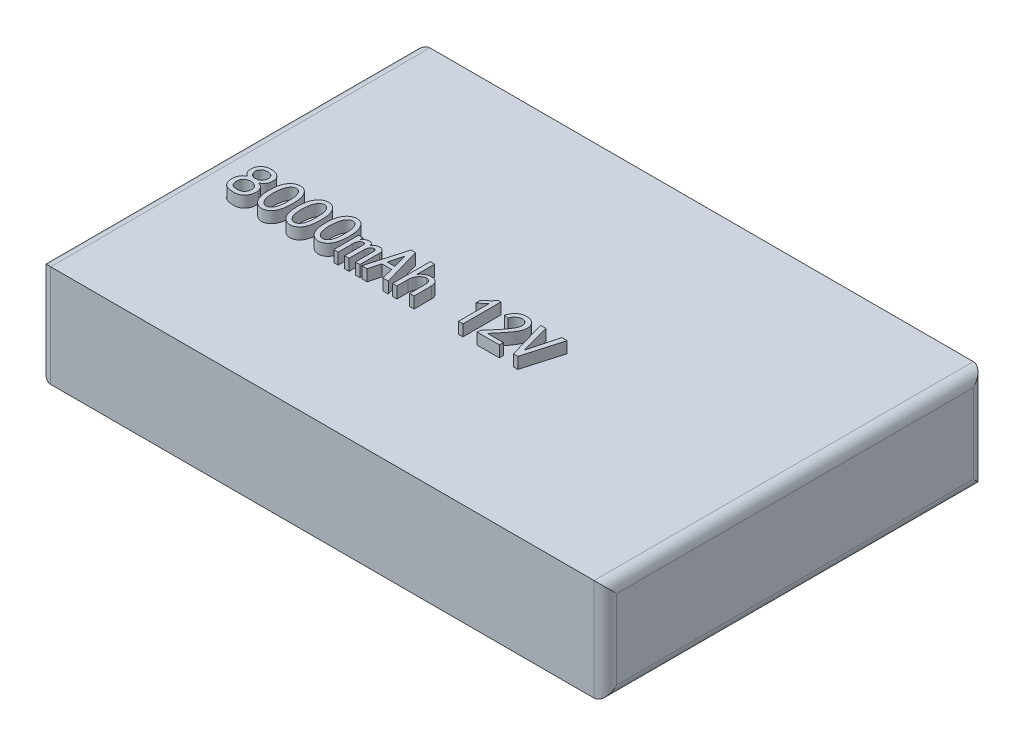
from build123d import *

# Parameters (mm, degrees)
SKETCH_1_W      = 100
SKETCH_1_H      = 67
EXTRUDE_1_DEPTH = 18
FILLET_1_R      = 2
EXTRUDE_2_DEPTH = 2


with BuildPart() as part:
    # 草图1 → 凸台-拉伸1 (new body)
    with BuildSketch(Plane(origin=(0, 0, 0), x_dir=(1, 0, 0), z_dir=(0, 1, 0))):
        with Locations((50, 33.5)):
            Rectangle(SKETCH_1_W, SKETCH_1_H)
    extrude(amount=EXTRUDE_1_DEPTH)

    # 圆角1
    fillet_1_edges = [part.edges().sort_by_distance(p)[0] for p in [
        (100, 18, -33.5),
        (0, 18, -33.5),
        (100, 0, -33.5),
        (0, 0, -33.5),
        (0, 9, -67),
        (100, 9, -67),
        (100, 9, 0),
        (0, 9, 0),
    ]]
    fillet(fillet_1_edges, radius=FILLET_1_R)

    # 草图3 → 凸台-拉伸2 (add)
    # profile 1 of 10: a face of its own
    with BuildSketch(Plane(origin=(0, 18, 0), x_dir=(1, 0, 0), z_dir=(0, 1, 0))):
        with BuildLine():
            add(Edge.make_bspline(
                [(11.582452743, 29.410355401), (11.586166957, 29.494181149), (11.593411207, 29.657675952), (11.614341343, 29.896069815), (11.639616615, 30.121689523), (11.672477807, 30.333845078), (11.713092583, 30.531830322), (11.759063521, 30.716682862), (11.812190182, 30.887885478), (11.890418071, 31.096974004), (12.007724524, 31.337632365), (12.17551857, 31.602133148), (12.370500827, 31.83990075), (12.554960243, 32.014120852), (12.714899037, 32.136737773), (12.842687085, 32.216348969), (12.976940509, 32.284370743), (13.11809958, 32.339843928), (13.265904721, 32.381166107), (13.419964352, 32.411673837), (13.580786928, 32.430546383), (13.746506674, 32.436161198), (13.913475146, 32.428299435), (14.077497758, 32.402688022), (14.235776716, 32.357221219), (14.388420095, 32.294802478), (14.535012479, 32.214602133), (14.67629178, 32.117264395), (14.81058309, 32.000271989), (14.939560133, 31.868375372), (15.060028466, 31.723212648), (15.170377192, 31.567585354), (15.270147919, 31.403098761), (15.358010789, 31.228850487), (15.436769418, 31.046377026), (15.502840905, 30.854053039), (15.557503666, 30.652659874), (15.617695927, 30.368156703), (15.670652066, 29.990770611), (15.707960335, 29.51314411), (15.71647351, 29.00386048), (15.703797245, 28.563434408), (15.679902191, 28.206587686), (15.652736156, 27.947762316), (15.616247461, 27.702126844), (15.573770277, 27.468485624), (15.52062875, 27.248081167), (15.457655471, 27.040677316), (15.389615667, 26.844919163), (15.309529144, 26.662864424), (15.222302353, 26.492967001), (15.122856353, 26.337403201), (15.015120496, 26.194071783), (14.896238839, 26.064108594), (14.764662525, 25.950131612), (14.624969299, 25.846641024), (14.473407586, 25.75855888), (14.314016088, 25.683812601), (14.149854846, 25.624324089), (13.982973327, 25.585551237), (13.816519664, 25.562506214), (13.649320878, 25.562421907), (13.482367588, 25.576959075), (13.316345433, 25.615199921), (13.149206573, 25.667776944), (12.985427889, 25.742130813), (12.827794772, 25.82774556), (12.679419983, 25.919892751), (12.544358408, 26.02016211), (12.42153089, 26.127241524), (12.309405193, 26.24023194), (12.209304568, 26.360206013), (12.122268009, 26.487495944), (12.025006237, 26.666639588), (11.920807817, 26.897713187), (11.812963032, 27.182340357), (11.724821117, 27.473813879), (11.668144071, 27.724292172), (11.630776974, 27.933836421), (11.61021753, 28.10561054), (11.592358561, 28.290518629), (11.581565112, 28.488603766), (11.574385651, 28.700037692), (11.571261028, 28.924971028), (11.57460539, 29.163377605), (11.579790778, 29.326576014), (11.582452743, 29.410355401)],
                knots=[0, 0, 0, 0, 1.18043416, 2.302333746, 3.366253517, 4.374302266, 5.321670991, 6.208995316, 7.053297808, 7.84229274, 9.348259463, 10.810477328, 12.240076564, 13.663562249, 14.3695339, 15.072606272, 15.778577923, 16.484387009, 17.202829605, 17.934942377, 18.692112664, 19.478485278, 20.265441384, 21.040673806, 21.808439453, 22.577161074, 23.356320991, 24.155029842, 24.986154494, 25.858111265, 26.748121484, 27.637306138, 28.540117759, 29.452135788, 30.380885827, 31.334339875, 32.310628684, 33.31521083, 35.42407972, 37.666773946, 40.052062172, 42.587025658, 43.863776122, 45.083322308, 46.247467896, 47.357025429, 48.423487632, 49.435172604, 50.405897663, 51.337337341, 52.231284254, 53.090220275, 53.931690991, 54.751583713, 55.562922169, 56.377338113, 57.194202079, 58.024663732, 58.851830165, 59.645552351, 60.431282623, 61.21044254, 61.99312915, 62.783838437, 63.60230231, 64.454612977, 65.309477934, 66.125301685, 66.909862715, 67.67340185, 68.415973016, 69.147238889, 69.868837108, 70.581506411, 72.0124375, 73.431838244, 74.861437481, 76.292961888, 77.042577341, 77.855187732, 78.726196438, 79.655959089, 80.645695907, 81.702690171, 82.820655125, 84, 84, 84, 84], degree=3))
        make_face()
        with BuildLine():
            add(Edge.make_bspline(
                [(12.401539305, 29.644380133), (12.392684128, 29.556316156), (12.375239122, 29.382827059), (12.360971218, 29.125459373), (12.356905251, 28.87537721), (12.360628569, 28.632479454), (12.374987458, 28.39724135), (12.399486149, 28.169207664), (12.434383806, 27.948538457), (12.477095455, 27.735818913), (12.528269894, 27.534448947), (12.588958673, 27.347164468), (12.658037112, 27.175329805), (12.734454099, 27.018686114), (12.818336594, 26.877046397), (12.911246582, 26.751214957), (13.010577381, 26.638514934), (13.119297521, 26.543803902), (13.230805841, 26.464267079), (13.344810676, 26.402467713), (13.45945268, 26.358676649), (13.575169416, 26.331900897), (13.691543793, 26.32335157), (13.808622211, 26.331632833), (13.925538636, 26.360536617), (14.041712329, 26.404835723), (14.153810223, 26.465849536), (14.259858752, 26.539524022), (14.357646773, 26.627507132), (14.447225988, 26.728854462), (14.528084162, 26.844192914), (14.602067943, 26.971550667), (14.667031324, 27.113040129), (14.743422668, 27.320205932), (14.820356046, 27.596095278), (14.888801583, 27.940842573), (14.929172439, 28.300369068), (14.939757254, 28.669243147), (14.932875016, 29.035765135), (14.924620637, 29.390823499), (14.904772683, 29.728418911), (14.881018622, 30.050270424), (14.840705762, 30.357815017), (14.76641453, 30.649441858), (14.662354326, 30.925941717), (14.555547801, 31.144210199), (14.453187433, 31.302648539), (14.372494355, 31.408956109), (14.282784238, 31.497788826), (14.188190124, 31.573519249), (14.086511533, 31.631174389), (13.978667996, 31.6743018), (13.864706605, 31.7010282), (13.746354409, 31.714206477), (13.62711863, 31.711902736), (13.510000311, 31.690974622), (13.396407403, 31.65437425), (13.285625158, 31.602269173), (13.179977891, 31.531746383), (13.077776888, 31.445433067), (12.980173521, 31.341875788), (12.88402792, 31.223885099), (12.796326402, 31.086874891), (12.715217994, 30.933397711), (12.643289933, 30.761481611), (12.578870916, 30.572121592), (12.521016428, 30.365327934), (12.472372443, 30.14097623), (12.432006531, 29.898887664), (12.41192654, 29.731149752), (12.401539305, 29.644380133)],
                knots=[0, 0, 0, 0, 1.378198314, 2.715098627, 4.012594964, 5.272602849, 6.497213731, 7.681415101, 8.842769074, 9.975170128, 11.059162755, 12.076494648, 13.038717388, 13.940857576, 14.788360499, 15.598271168, 16.373595835, 17.122768248, 17.838466736, 18.502782022, 19.136468245, 19.744060339, 20.345653328, 20.947246317, 21.563841626, 22.214212994, 22.87852828, 23.546305104, 24.220743313, 24.921956094, 25.648106704, 26.41081768, 27.212668989, 28.069279432, 29.84713992, 31.666334073, 33.537864714, 35.473745168, 37.408579624, 39.246547954, 41.003985019, 42.674193204, 44.272363647, 45.827394737, 47.348405091, 48.867584295, 49.599750274, 50.283750763, 50.94125936, 51.560811542, 52.165388272, 52.754418158, 53.363720025, 53.982318455, 54.604903792, 55.213928724, 55.828148287, 56.458765578, 57.113918044, 57.800421407, 58.537638978, 59.326979919, 60.167286366, 61.066273245, 62.027297208, 63.065989643, 64.179487018, 65.369443928, 66.639232213, 68, 68, 68, 68], degree=3))
        make_face(mode=Mode.SUBTRACT)
    # profile 2 of 10: a face of its own
    with BuildSketch(Plane(origin=(0, 18, 0), x_dir=(1, 0, 0), z_dir=(0, 1, 0))):
        with BuildLine():
            add(Edge.make_bspline(
                [(16.574980359, 29.410355401), (16.578694572, 29.494181149), (16.585938822, 29.657675952), (16.606868959, 29.896069815), (16.63214423, 30.121689523), (16.665005422, 30.333845078), (16.705620198, 30.531830322), (16.751591136, 30.716682862), (16.804717797, 30.887885478), (16.882945687, 31.096974004), (17.000252139, 31.337632365), (17.168046186, 31.602133148), (17.363028442, 31.83990075), (17.547487859, 32.014120852), (17.707426652, 32.136737773), (17.8352147, 32.216348969), (17.969468124, 32.284370743), (18.110627196, 32.339843928), (18.258432337, 32.381166107), (18.412491967, 32.411673837), (18.573314544, 32.430546383), (18.73903429, 32.436161198), (18.906002761, 32.428299435), (19.070025374, 32.402688022), (19.228304331, 32.357221219), (19.380947711, 32.294802478), (19.527540094, 32.214602133), (19.668819395, 32.117264395), (19.803110705, 32.000271989), (19.932087748, 31.868375372), (20.052556082, 31.723212648), (20.162904807, 31.567585354), (20.262675535, 31.403098761), (20.350538404, 31.228850487), (20.429297033, 31.046377026), (20.49536852, 30.854053039), (20.550031281, 30.652659874), (20.610223542, 30.368156703), (20.663179682, 29.990770611), (20.70048795, 29.51314411), (20.709001126, 29.00386048), (20.69632486, 28.563434408), (20.672429806, 28.206587686), (20.645263772, 27.947762316), (20.608775076, 27.702126844), (20.566297893, 27.468485624), (20.513156365, 27.248081167), (20.450183086, 27.040677316), (20.382143282, 26.844919163), (20.302056759, 26.662864424), (20.214829968, 26.492967001), (20.115383969, 26.337403201), (20.007648111, 26.194071783), (19.888766455, 26.064108594), (19.757190141, 25.950131612), (19.617496914, 25.846641024), (19.465935201, 25.75855888), (19.306543704, 25.683812601), (19.142382461, 25.624324089), (18.975500942, 25.585551237), (18.80904728, 25.562506214), (18.641848494, 25.562421907), (18.474895203, 25.576959075), (18.308873048, 25.615199921), (18.141734188, 25.667776944), (17.977955504, 25.742130813), (17.820322387, 25.82774556), (17.671947598, 25.919892751), (17.536886023, 26.02016211), (17.414058505, 26.127241524), (17.301932808, 26.24023194), (17.201832183, 26.360206013), (17.114795624, 26.487495944), (17.017533853, 26.666639588), (16.913335433, 26.897713187), (16.805490648, 27.182340357), (16.717348732, 27.473813879), (16.660671687, 27.724292172), (16.623304589, 27.933836421), (16.602745145, 28.10561054), (16.584886176, 28.290518629), (16.574092727, 28.488603766), (16.566913266, 28.700037692), (16.563788644, 28.924971028), (16.567133006, 29.163377605), (16.572318393, 29.326576014), (16.574980359, 29.410355401)],
                knots=[0, 0, 0, 0, 1.18043416, 2.302333746, 3.366253517, 4.374302266, 5.321670991, 6.208995316, 7.053297808, 7.84229274, 9.348259463, 10.810477328, 12.240076564, 13.663562249, 14.3695339, 15.072606272, 15.778577923, 16.484387009, 17.202829605, 17.934942377, 18.692112664, 19.478485278, 20.265441384, 21.040673806, 21.808439453, 22.577161074, 23.356320991, 24.155029842, 24.986154494, 25.858111265, 26.748121484, 27.637306138, 28.540117759, 29.452135788, 30.380885827, 31.334339875, 32.310628684, 33.31521083, 35.42407972, 37.666773946, 40.052062172, 42.587025658, 43.863776122, 45.083322308, 46.247467896, 47.357025429, 48.423487632, 49.435172604, 50.405897663, 51.337337341, 52.231284254, 53.090220275, 53.931690991, 54.751583713, 55.562922169, 56.377338113, 57.194202079, 58.024663732, 58.851830165, 59.645552351, 60.431282623, 61.21044254, 61.99312915, 62.783838437, 63.60230231, 64.454612977, 65.309477934, 66.125301685, 66.909862715, 67.67340185, 68.415973016, 69.147238889, 69.868837108, 70.581506411, 72.0124375, 73.431838244, 74.861437481, 76.292961888, 77.042577341, 77.855187732, 78.726196438, 79.655959089, 80.645695907, 81.702690171, 82.820655125, 84, 84, 84, 84], degree=3))
        make_face()
        with BuildLine():
            add(Edge.make_bspline(
                [(17.39406692, 29.644380133), (17.385211744, 29.556316156), (17.367766737, 29.382827059), (17.353498833, 29.125459373), (17.349432866, 28.87537721), (17.353156185, 28.632479454), (17.367515074, 28.39724135), (17.392013765, 28.169207664), (17.426911422, 27.948538457), (17.469623071, 27.735818913), (17.52079751, 27.534448947), (17.581486289, 27.347164468), (17.650564728, 27.175329805), (17.726981714, 27.018686114), (17.810864209, 26.877046397), (17.903774198, 26.751214957), (18.003104997, 26.638514934), (18.111825136, 26.543803902), (18.223333456, 26.464267079), (18.337338292, 26.402467713), (18.451980295, 26.358676649), (18.567697031, 26.331900897), (18.684071408, 26.32335157), (18.801149827, 26.331632833), (18.918066252, 26.360536617), (19.034239944, 26.404835723), (19.146337838, 26.465849536), (19.252386367, 26.539524022), (19.350174389, 26.627507132), (19.439753603, 26.728854462), (19.520611778, 26.844192914), (19.594595558, 26.971550667), (19.65955894, 27.113040129), (19.735950284, 27.320205932), (19.812883661, 27.596095278), (19.881329199, 27.940842573), (19.921700054, 28.300369068), (19.93228487, 28.669243147), (19.925402631, 29.035765135), (19.917148253, 29.390823499), (19.897300298, 29.728418911), (19.873546237, 30.050270424), (19.833233377, 30.357815017), (19.758942146, 30.649441858), (19.654881941, 30.925941717), (19.548075417, 31.144210199), (19.445715049, 31.302648539), (19.36502197, 31.408956109), (19.275311854, 31.497788826), (19.180717739, 31.573519249), (19.079039148, 31.631174389), (18.971195611, 31.6743018), (18.85723422, 31.7010282), (18.738882024, 31.714206477), (18.619646245, 31.711902736), (18.502527926, 31.690974622), (18.388935018, 31.65437425), (18.278152773, 31.602269173), (18.172505506, 31.531746383), (18.070304503, 31.445433067), (17.972701136, 31.341875788), (17.876555536, 31.223885099), (17.788854017, 31.086874891), (17.70774561, 30.933397711), (17.635817548, 30.761481611), (17.571398531, 30.572121592), (17.513544044, 30.365327934), (17.464900059, 30.14097623), (17.424534146, 29.898887664), (17.404454156, 29.731149752), (17.39406692, 29.644380133)],
                knots=[0, 0, 0, 0, 1.378198314, 2.715098627, 4.012594964, 5.272602849, 6.497213731, 7.681415101, 8.842769074, 9.975170128, 11.059162755, 12.076494648, 13.038717388, 13.940857576, 14.788360499, 15.598271168, 16.373595835, 17.122768248, 17.838466736, 18.502782022, 19.136468245, 19.744060339, 20.345653328, 20.947246317, 21.563841626, 22.214212994, 22.87852828, 23.546305104, 24.220743313, 24.921956094, 25.648106704, 26.41081768, 27.212668989, 28.069279432, 29.84713992, 31.666334073, 33.537864714, 35.473745168, 37.408579624, 39.246547954, 41.003985019, 42.674193204, 44.272363647, 45.827394737, 47.348405091, 48.867584295, 49.599750274, 50.283750763, 50.94125936, 51.560811542, 52.165388272, 52.754418158, 53.363720025, 53.982318455, 54.604903792, 55.213928724, 55.828148287, 56.458765578, 57.113918044, 57.800421407, 58.537638978, 59.326979919, 60.167286366, 61.066273245, 62.027297208, 63.065989643, 64.179487018, 65.369443928, 66.639232213, 68, 68, 68, 68], degree=3))
        make_face(mode=Mode.SUBTRACT)
    # profile 3 of 10: a face of its own
    with BuildSketch(Plane(origin=(0, 18, 0), x_dir=(1, 0, 0), z_dir=(0, 1, 0))):
        with BuildLine():
            add(Edge.make_bspline(
                [(21.567507974, 29.410355401), (21.571222188, 29.494181149), (21.578466438, 29.657675952), (21.599396574, 29.896069815), (21.624671845, 30.121689523), (21.657533038, 30.333845078), (21.698147813, 30.531830322), (21.744118752, 30.716682862), (21.797245413, 30.887885478), (21.875473302, 31.096974004), (21.992779754, 31.337632365), (22.160573801, 31.602133148), (22.355556057, 31.83990075), (22.540015474, 32.014120852), (22.699954268, 32.136737773), (22.827742316, 32.216348969), (22.961995739, 32.284370743), (23.103154811, 32.339843928), (23.250959952, 32.381166107), (23.405019582, 32.411673837), (23.565842159, 32.430546383), (23.731561905, 32.436161198), (23.898530377, 32.428299435), (24.062552989, 32.402688022), (24.220831947, 32.357221219), (24.373475326, 32.294802478), (24.520067709, 32.214602133), (24.66134701, 32.117264395), (24.79563832, 32.000271989), (24.924615364, 31.868375372), (25.045083697, 31.723212648), (25.155432423, 31.567585354), (25.25520315, 31.403098761), (25.343066019, 31.228850487), (25.421824648, 31.046377026), (25.487896135, 30.854053039), (25.542558897, 30.652659874), (25.602751157, 30.368156703), (25.655707297, 29.990770611), (25.693015566, 29.51314411), (25.701528741, 29.00386048), (25.688852475, 28.563434408), (25.664957421, 28.206587686), (25.637791387, 27.947762316), (25.601302692, 27.702126844), (25.558825508, 27.468485624), (25.505683981, 27.248081167), (25.442710702, 27.040677316), (25.374670898, 26.844919163), (25.294584375, 26.662864424), (25.207357583, 26.492967001), (25.107911584, 26.337403201), (25.000175726, 26.194071783), (24.88129407, 26.064108594), (24.749717756, 25.950131612), (24.61002453, 25.846641024), (24.458462817, 25.75855888), (24.299071319, 25.683812601), (24.134910077, 25.624324089), (23.968028557, 25.585551237), (23.801574895, 25.562506214), (23.634376109, 25.562421907), (23.467422818, 25.576959075), (23.301400664, 25.615199921), (23.134261804, 25.667776944), (22.97048312, 25.742130813), (22.812850002, 25.82774556), (22.664475214, 25.919892751), (22.529413639, 26.02016211), (22.40658612, 26.127241524), (22.294460423, 26.24023194), (22.194359799, 26.360206013), (22.107323239, 26.487495944), (22.010061468, 26.666639588), (21.905863048, 26.897713187), (21.798018263, 27.182340357), (21.709876348, 27.473813879), (21.653199302, 27.724292172), (21.615832205, 27.933836421), (21.59527276, 28.10561054), (21.577413791, 28.290518629), (21.566620342, 28.488603766), (21.559440881, 28.700037692), (21.556316259, 28.924971028), (21.559660621, 29.163377605), (21.564846008, 29.326576014), (21.567507974, 29.410355401)],
                knots=[0, 0, 0, 0, 1.18043416, 2.302333746, 3.366253517, 4.374302266, 5.321670991, 6.208995316, 7.053297808, 7.84229274, 9.348259463, 10.810477328, 12.240076564, 13.663562249, 14.3695339, 15.072606272, 15.778577923, 16.484387009, 17.202829605, 17.934942377, 18.692112664, 19.478485278, 20.265441384, 21.040673806, 21.808439453, 22.577161074, 23.356320991, 24.155029842, 24.986154494, 25.858111265, 26.748121484, 27.637306138, 28.540117759, 29.452135788, 30.380885827, 31.334339875, 32.310628684, 33.31521083, 35.42407972, 37.666773946, 40.052062172, 42.587025658, 43.863776122, 45.083322308, 46.247467896, 47.357025429, 48.423487632, 49.435172604, 50.405897663, 51.337337341, 52.231284254, 53.090220275, 53.931690991, 54.751583713, 55.562922169, 56.377338113, 57.194202079, 58.024663732, 58.851830165, 59.645552351, 60.431282623, 61.21044254, 61.99312915, 62.783838437, 63.60230231, 64.454612977, 65.309477934, 66.125301685, 66.909862715, 67.67340185, 68.415973016, 69.147238889, 69.868837108, 70.581506411, 72.0124375, 73.431838244, 74.861437481, 76.292961888, 77.042577341, 77.855187732, 78.726196438, 79.655959089, 80.645695907, 81.702690171, 82.820655125, 84, 84, 84, 84], degree=3))
        make_face()
        with BuildLine():
            add(Edge.make_bspline(
                [(22.386594536, 29.644380133), (22.377739359, 29.556316156), (22.360294353, 29.382827059), (22.346026449, 29.125459373), (22.341960482, 28.87537721), (22.3456838, 28.632479454), (22.360042689, 28.39724135), (22.38454138, 28.169207664), (22.419439037, 27.948538457), (22.462150686, 27.735818913), (22.513325125, 27.534448947), (22.574013904, 27.347164468), (22.643092343, 27.175329805), (22.71950933, 27.018686114), (22.803391824, 26.877046397), (22.896301813, 26.751214957), (22.995632612, 26.638514934), (23.104352751, 26.543803902), (23.215861072, 26.464267079), (23.329865907, 26.402467713), (23.444507911, 26.358676649), (23.560224647, 26.331900897), (23.676599024, 26.32335157), (23.793677442, 26.331632833), (23.910593867, 26.360536617), (24.02676756, 26.404835723), (24.138865453, 26.465849536), (24.244913983, 26.539524022), (24.342702004, 26.627507132), (24.432281218, 26.728854462), (24.513139393, 26.844192914), (24.587123173, 26.971550667), (24.652086555, 27.113040129), (24.728477899, 27.320205932), (24.805411277, 27.596095278), (24.873856814, 27.940842573), (24.914227669, 28.300369068), (24.924812485, 28.669243147), (24.917930246, 29.035765135), (24.909675868, 29.390823499), (24.889827913, 29.728418911), (24.866073853, 30.050270424), (24.825760993, 30.357815017), (24.751469761, 30.649441858), (24.647409556, 30.925941717), (24.540603032, 31.144210199), (24.438242664, 31.302648539), (24.357549586, 31.408956109), (24.267839469, 31.497788826), (24.173245355, 31.573519249), (24.071566764, 31.631174389), (23.963723226, 31.6743018), (23.849761835, 31.7010282), (23.731409639, 31.714206477), (23.61217386, 31.711902736), (23.495055542, 31.690974622), (23.381462634, 31.65437425), (23.270680389, 31.602269173), (23.165033121, 31.531746383), (23.062832118, 31.445433067), (22.965228751, 31.341875788), (22.869083151, 31.223885099), (22.781381632, 31.086874891), (22.700273225, 30.933397711), (22.628345164, 30.761481611), (22.563926147, 30.572121592), (22.506071659, 30.365327934), (22.457427674, 30.14097623), (22.417061761, 29.898887664), (22.396981771, 29.731149752), (22.386594536, 29.644380133)],
                knots=[0, 0, 0, 0, 1.378198314, 2.715098627, 4.012594964, 5.272602849, 6.497213731, 7.681415101, 8.842769074, 9.975170128, 11.059162755, 12.076494648, 13.038717388, 13.940857576, 14.788360499, 15.598271168, 16.373595835, 17.122768248, 17.838466736, 18.502782022, 19.136468245, 19.744060339, 20.345653328, 20.947246317, 21.563841626, 22.214212994, 22.87852828, 23.546305104, 24.220743313, 24.921956094, 25.648106704, 26.41081768, 27.212668989, 28.069279432, 29.84713992, 31.666334073, 33.537864714, 35.473745168, 37.408579624, 39.246547954, 41.003985019, 42.674193204, 44.272363647, 45.827394737, 47.348405091, 48.867584295, 49.599750274, 50.283750763, 50.94125936, 51.560811542, 52.165388272, 52.754418158, 53.363720025, 53.982318455, 54.604903792, 55.213928724, 55.828148287, 56.458765578, 57.113918044, 57.800421407, 58.537638978, 59.326979919, 60.167286366, 61.066273245, 62.027297208, 63.065989643, 64.179487018, 65.369443928, 66.639232213, 68, 68, 68, 68], degree=3))
        make_face(mode=Mode.SUBTRACT)
    # profile 4 of 10: a face of its own
    with BuildSketch(Plane(origin=(0, 18, 0), x_dir=(1, 0, 0), z_dir=(0, 1, 0))):
        with BuildLine():
            add(Edge.make_bspline(
                [(6.511916884, 27.597386027), (6.514573962, 27.675137098), (6.519915546, 27.831441862), (6.567433631, 28.063062747), (6.639866305, 28.292615958), (6.724863209, 28.478866239), (6.807770512, 28.624380004), (6.882027286, 28.728282482), (6.965105126, 28.827262847), (7.057047367, 28.921434658), (7.161043995, 29.008115449), (7.27342279, 29.090197811), (7.39520548, 29.167593719), (7.48184348, 29.212605591), (7.526024056, 29.23555915)],
                knots=[0, 0, 0, 0, 1.374126598, 2.76243824, 4.166032791, 5.626085304, 6.374165685, 7.125778304, 7.881627021, 8.658683375, 9.450540369, 10.273494042, 11.119577685, 12, 12, 12, 12], degree=3))
            add(Edge.make_bspline(
                [(7.526024056, 29.23555915), (7.453617506, 29.280608375), (7.316142163, 29.366141488), (7.137940447, 29.513487045), (6.998625432, 29.669552251), (6.897566749, 29.835877045), (6.828952568, 30.01251795), (6.777150728, 30.198026836), (6.74092688, 30.395273871), (6.722859493, 30.599795453), (6.721936246, 30.803463434), (6.741881562, 30.997194786), (6.78049314, 31.176755555), (6.839131227, 31.342611411), (6.917414935, 31.498161824), (7.013955008, 31.646095108), (7.123448313, 31.792304105), (7.251038675, 31.928417388), (7.388713029, 32.053745024), (7.536699232, 32.158888872), (7.69278065, 32.240843925), (7.857181261, 32.299781557), (8.027808209, 32.342422035), (8.205587146, 32.372615095), (8.389934152, 32.391682485), (8.579131441, 32.39631723), (8.766706499, 32.392511573), (8.94765456, 32.378333044), (9.118463808, 32.353777901), (9.282807053, 32.319439369), (9.444540155, 32.2675851), (9.609589989, 32.196813226), (9.776097409, 32.098642969), (9.948650079, 31.986961971), (10.112398649, 31.848746956), (10.252627612, 31.679147417), (10.368975423, 31.483561831), (10.442855853, 31.300934483), (10.486068779, 31.143493843), (10.511533808, 31.019120735), (10.523697199, 30.889437646), (10.527232979, 30.755136323), (10.517058675, 30.615773126), (10.500829477, 30.471253347), (10.470794085, 30.322403601), (10.432771689, 30.170430576), (10.382818123, 30.018751556), (10.310858974, 29.875022178), (10.221665865, 29.739683803), (10.116271996, 29.61201225), (9.991334502, 29.494276754), (9.84988421, 29.384503698), (9.689522094, 29.284601724), (9.574464948, 29.226477171), (9.515234277, 29.196555028)],
                knots=[0, 0, 0, 0, 1.410033332, 2.677172402, 3.812064432, 4.856127883, 5.878591605, 6.938109193, 8.03995885, 9.192064022, 10.3315345, 11.405101817, 12.408541443, 13.363710648, 14.308049618, 15.282826904, 16.283668828, 17.326789228, 18.365059226, 19.359919842, 20.322241493, 21.272612498, 22.242786748, 23.229219042, 24.254411489, 25.306713209, 26.358803724, 27.358026599, 28.307996659, 29.212919167, 30.132734509, 31.114165642, 32.177631088, 33.326839266, 34.513504529, 35.70718515, 36.950754538, 38.266204093, 38.952498493, 39.651034787, 40.363832527, 41.105058096, 41.871509902, 42.674059092, 43.510125888, 44.381738271, 45.266222349, 46.146424753, 47.03266586, 47.943741995, 48.879333301, 49.867534116, 50.90222043, 52, 52, 52, 52], degree=3))
            add(Edge.make_bspline(
                [(9.515234277, 29.196555028), (9.568955509, 29.180006832), (9.673285834, 29.147869098), (9.820712598, 29.088116233), (9.956388187, 29.022668852), (10.080722725, 28.951850073), (10.191032017, 28.87063298), (10.291624915, 28.786288339), (10.379115409, 28.693314597), (10.476766931, 28.559156992), (10.57828873, 28.377242725), (10.664150304, 28.136609625), (10.713620919, 27.874016633), (10.729189287, 27.598877883), (10.716496059, 27.32883689), (10.687779025, 27.078443481), (10.631439049, 26.857196818), (10.553908136, 26.664189131), (10.461138143, 26.495430169), (10.367065038, 26.340941522), (10.266809738, 26.201225197), (10.160554906, 26.074669234), (10.042058664, 25.960602639), (9.903982394, 25.861918101), (9.746668414, 25.775427312), (9.570039015, 25.699911354), (9.370605624, 25.640101716), (9.147673366, 25.60002055), (8.900485101, 25.57394322), (8.636433517, 25.566627923), (8.370011332, 25.574167706), (8.116127599, 25.600265548), (7.880980597, 25.641093425), (7.664713664, 25.700349538), (7.466103632, 25.775923136), (7.287782827, 25.873835819), (7.122251203, 25.981948672), (6.978059033, 26.112006365), (6.851966195, 26.254658313), (6.746584887, 26.410119989), (6.665263429, 26.57884412), (6.604206249, 26.759494125), (6.564458657, 26.952980413), (6.534036864, 27.156972825), (6.514612252, 27.373101146), (6.51283171, 27.521262222), (6.511916884, 27.597386027)],
                knots=[0, 0, 0, 0, 0.834664037, 1.620974963, 2.359958192, 3.071500661, 3.742523023, 4.391885647, 5.019370884, 5.633088925, 6.853041206, 8.099687998, 9.411290177, 10.808708308, 12.183221387, 13.42351142, 14.545940998, 15.563362997, 16.504155904, 17.403380615, 18.249005911, 19.055869055, 19.855247075, 20.685085447, 21.568786071, 22.517377533, 23.533390568, 24.654269325, 25.877028168, 27.222423441, 28.574967808, 29.833297063, 31.01045681, 32.11582339, 33.159850443, 34.158288642, 35.132345709, 36.089875077, 37.032569401, 37.955047952, 38.86995275, 39.806385064, 40.780048122, 41.799705361, 42.869508764, 44, 44, 44, 44], degree=3))
        make_face()
        with BuildLine():
            add(Edge.make_bspline(
                [(7.310779086, 27.636390149), (7.309884026, 27.560712463), (7.308144013, 27.413593703), (7.336362448, 27.200065513), (7.387164733, 27.001050567), (7.448362663, 26.845764794), (7.51410334, 26.732799521), (7.57197101, 26.655912026), (7.638970072, 26.586790822), (7.716440976, 26.528348477), (7.801398771, 26.474819862), (7.896272648, 26.431015454), (8.00034778, 26.394602341), (8.150631628, 26.356562248), (8.348332925, 26.329470175), (8.591002562, 26.319681889), (8.838217382, 26.340448898), (9.045091557, 26.375018217), (9.206331399, 26.420693807), (9.319618248, 26.463431228), (9.422944154, 26.517170265), (9.516376245, 26.580930403), (9.598874505, 26.6556642), (9.673543532, 26.738172438), (9.73757952, 26.831497328), (9.806806081, 26.967926843), (9.874621313, 27.14448884), (9.924327805, 27.361481114), (9.944296027, 27.577922426), (9.931826704, 27.757514776), (9.90605501, 27.897907422), (9.874281341, 27.999403779), (9.829928698, 28.096027021), (9.774940824, 28.188658656), (9.70801714, 28.277711848), (9.627909097, 28.360753757), (9.537917818, 28.440909138), (9.404036813, 28.539774313), (9.223301381, 28.643427133), (8.991606005, 28.731923473), (8.748408057, 28.772945018), (8.501723171, 28.773677974), (8.261418381, 28.73856586), (8.036998322, 28.668294823), (7.835812323, 28.560162517), (7.68679076, 28.444932699), (7.58316259, 28.337628873), (7.515189801, 28.251562879), (7.454598213, 28.162290934), (7.40766351, 28.065830218), (7.368190123, 27.965459044), (7.337373553, 27.860265142), (7.319055794, 27.749624082), (7.313563804, 27.674487975), (7.310779086, 27.636390149)],
                knots=[0, 0, 0, 0, 1.45021583, 2.819245253, 4.116311686, 5.383839525, 6.004804309, 6.61809702, 7.225519428, 7.844420058, 8.474928218, 9.148418113, 9.843660174, 10.58739695, 12.118283095, 13.661739419, 15.236493707, 16.868915606, 17.675810439, 18.447690583, 19.187171155, 19.904516724, 20.610957382, 21.317398041, 22.03474361, 22.774224182, 24.247695365, 25.650274601, 27.031710525, 28.40179887, 29.088335786, 29.76605575, 30.435671148, 31.123139383, 31.828794671, 32.567062931, 33.332561727, 34.137975047, 35.755592712, 37.313353339, 38.869799076, 40.458468512, 42.027252455, 43.511108451, 44.944907386, 46.386035674, 47.104569492, 47.801282449, 48.487819365, 49.169367754, 49.853726664, 50.555320331, 51.267473945, 52, 52, 52, 52], degree=3))
        make_face(mode=Mode.SUBTRACT)
        with BuildLine():
            add(Edge.make_bspline(
                [(7.448015812, 30.678711664), (7.451475795, 30.614345343), (7.458423975, 30.485087868), (7.511695107, 30.294272577), (7.59845983, 30.109229348), (7.696890591, 29.962700914), (7.79240843, 29.853876479), (7.876243403, 29.782306104), (7.969106365, 29.72096132), (8.073029667, 29.672107773), (8.185779482, 29.633031323), (8.308378212, 29.605544657), (8.44052753, 29.59053843), (8.579135908, 29.584547333), (8.718219125, 29.590602352), (8.851316871, 29.60556333), (8.975380836, 29.632980854), (9.089872167, 29.672436739), (9.196343689, 29.720847524), (9.292212477, 29.782663238), (9.380108907, 29.853741222), (9.457411711, 29.936047311), (9.524798253, 30.026022284), (9.584562714, 30.11980572), (9.634303404, 30.21890945), (9.672491494, 30.322323964), (9.70243959, 30.429477485), (9.720355548, 30.540938766), (9.730908675, 30.656800676), (9.73072316, 30.775246192), (9.720722231, 30.891653457), (9.702402184, 31.002575173), (9.673805618, 31.105480151), (9.634301987, 31.200426324), (9.585462121, 31.287774329), (9.52509869, 31.365966331), (9.457312449, 31.437931822), (9.378074621, 31.499582078), (9.292056314, 31.555015583), (9.196727674, 31.599187149), (9.095533882, 31.637260157), (8.986599159, 31.665894955), (8.870611895, 31.68600973), (8.746964797, 31.697365619), (8.616154917, 31.700077734), (8.48115403, 31.693806326), (8.347841155, 31.681931064), (8.221657403, 31.660518541), (8.105831155, 31.630003124), (8.000112966, 31.59305509), (7.904645133, 31.547650465), (7.818978322, 31.49486661), (7.744672392, 31.431915708), (7.660930329, 31.339509377), (7.574921034, 31.212502873), (7.502879815, 31.045101948), (7.455230007, 30.866234237), (7.450454601, 30.742104467), (7.448015812, 30.678711664)],
                knots=[0, 0, 0, 0, 1.534693845, 3.081901317, 4.691243309, 6.396534232, 7.275531407, 8.139372323, 9.019120457, 9.923811509, 10.872401943, 11.862147786, 12.91556615, 14.042756034, 15.169945918, 16.234774491, 17.235732746, 18.195190674, 19.120665344, 20.019718268, 20.909987491, 21.812339702, 22.706457796, 23.589652117, 24.463374508, 25.347092071, 26.216951264, 27.114386788, 28.037289102, 28.991155695, 29.936957382, 30.823062971, 31.670776101, 32.479662527, 33.27221946, 34.051415611, 34.83171274, 35.625019215, 36.441220146, 37.268830285, 38.126995544, 39.019043232, 39.952404705, 40.933573035, 41.979631126, 43.072373492, 44.157596343, 45.172184403, 46.122722093, 47.013287973, 47.840898113, 48.641248973, 49.407885578, 50.156214404, 51.612891957, 53.043495678, 54.490119686, 56, 56, 56, 56], degree=3))
        make_face(mode=Mode.SUBTRACT)
    # profile 5 of 10: a face of its own
    with BuildSketch(Plane(origin=(0, 18, 0), x_dir=(1, 0, 0), z_dir=(0, 1, 0))):
        with BuildLine():
            Line((30.967501375, 25.647179927), (30.187418935, 25.647179927))
            Line((30.187418935, 25.647179927), (30.187418935, 28.806513808))
            add(Edge.make_bspline(
                [(30.187418935, 28.806513808), (30.186765559, 28.844120179), (30.185512019, 28.916270311), (30.171103668, 29.019577344), (30.146528735, 29.112769722), (30.113259661, 29.196332239), (30.063831555, 29.267843244), (29.991773376, 29.31922202), (29.899994175, 29.347483624), (29.833211929, 29.350794797), (29.797377715, 29.352571516)],
                knots=[0, 0, 0, 0, 1.172990478, 2.250454306, 3.245547364, 4.174930135, 5.046638938, 5.918347741, 6.883020922, 8, 8, 8, 8], degree=3))
            add(Edge.make_bspline(
                [(29.797377715, 29.352571516), (29.752021073, 29.34882655), (29.659922169, 29.34122221), (29.527403324, 29.280865253), (29.40137426, 29.186876), (29.284038299, 29.059127265), (29.181275527, 28.903752032), (29.109085749, 28.720796259), (29.063310236, 28.517443597), (29.058692866, 28.373878766), (29.056299397, 28.299460222)],
                knots=[0, 0, 0, 0, 0.766913604, 1.557256011, 2.427911044, 3.421802423, 4.484200412, 5.568564768, 6.739636535, 8, 8, 8, 8], degree=3))
            Line((29.056299397, 28.299460222), (29.056299397, 25.647179927))
            Line((29.056299397, 25.647179927), (28.276216957, 25.647179927))
            Line((28.276216957, 25.647179927), (28.276216957, 28.806513808))
            add(Edge.make_bspline(
                [(28.276216957, 28.806513808), (28.275563582, 28.844120179), (28.274310041, 28.916270311), (28.25990169, 29.019577344), (28.235326757, 29.112769722), (28.202057684, 29.196332239), (28.152629577, 29.267843244), (28.080571398, 29.31922202), (27.988792198, 29.347483624), (27.922009951, 29.350794797), (27.886175737, 29.352571516)],
                knots=[0, 0, 0, 0, 1.172990478, 2.250454306, 3.245547364, 4.174930135, 5.046638938, 5.918347741, 6.883020922, 8, 8, 8, 8], degree=3))
            add(Edge.make_bspline(
                [(27.886175737, 29.352571516), (27.840819096, 29.34882655), (27.748720192, 29.34122221), (27.616201347, 29.280865253), (27.490172282, 29.186876), (27.372836321, 29.059127265), (27.270073549, 28.903752032), (27.197883771, 28.720796259), (27.152108258, 28.517443597), (27.147490888, 28.373878766), (27.145097419, 28.299460222)],
                knots=[0, 0, 0, 0, 0.766913604, 1.557256011, 2.427911044, 3.421802423, 4.484200412, 5.568564768, 6.739636535, 8, 8, 8, 8], degree=3))
            Line((27.145097419, 28.299460222), (27.145097419, 25.647179927))
            Line((27.145097419, 25.647179927), (26.365014979, 25.647179927))
            Line((26.365014979, 25.647179927), (26.365014979, 30.01564159))
            Line((26.365014979, 30.01564159), (27.145097419, 30.01564159))
            Line((27.145097419, 30.01564159), (27.145097419, 29.43057976))
            add(Edge.make_bspline(
                [(27.145097419, 29.43057976), (27.178164455, 29.480538569), (27.242919918, 29.578373335), (27.357377627, 29.708277355), (27.478121937, 29.824110096), (27.610358711, 29.919384278), (27.749356457, 29.996466433), (27.894038143, 30.054223364), (28.045139571, 30.086226792), (28.147028686, 30.091167874), (28.198208713, 30.093649834)],
                knots=[0, 0, 0, 0, 1.105035383, 2.164000341, 3.189319476, 4.188868779, 5.163914028, 6.118307184, 7.054804926, 8, 8, 8, 8], degree=3))
            add(Edge.make_bspline(
                [(28.198208713, 30.093649834), (28.248439929, 30.091303428), (28.345630992, 30.086763429), (28.486224516, 30.05517658), (28.612947584, 29.997666526), (28.726624229, 29.919827337), (28.827980066, 29.824817032), (28.908195845, 29.707939962), (28.975314379, 29.576705252), (29.003009258, 29.480305978), (29.017295275, 29.43057976)],
                knots=[0, 0, 0, 0, 1.054125019, 2.039598852, 3.00311637, 3.956135942, 4.921083366, 5.899693326, 6.916586166, 8, 8, 8, 8], degree=3))
            add(Edge.make_bspline(
                [(29.017295275, 29.43057976), (29.050028308, 29.480405634), (29.113759789, 29.577417015), (29.223491678, 29.707875789), (29.338398561, 29.82293305), (29.462236251, 29.9197266), (29.594010192, 29.996193292), (29.732634382, 30.054961888), (29.880268991, 30.08621425), (29.980713988, 30.091156023), (30.031402447, 30.093649834)],
                knots=[0, 0, 0, 0, 1.127724244, 2.195688248, 3.220611048, 4.201621127, 5.161610027, 6.097757614, 7.040054382, 8, 8, 8, 8], degree=3))
            add(Edge.make_bspline(
                [(30.031402447, 30.093649834), (30.104883796, 30.090980613), (30.243970255, 30.085928277), (30.438355872, 30.038335122), (30.604150204, 29.958152549), (30.738983529, 29.843747748), (30.842934462, 29.700046894), (30.91745597, 29.52981864), (30.960337386, 29.332514665), (30.965027269, 29.192441263), (30.967501375, 29.118546784)],
                knots=[0, 0, 0, 0, 1.141342915, 2.160348787, 3.088109297, 3.980870533, 4.881139354, 5.823297628, 6.851700002, 8, 8, 8, 8], degree=3))
            Line((30.967501375, 29.118546784), (30.967501375, 25.647179927))
        make_face()
    # profile 6 of 10: a face of its own
    with BuildSketch(Plane(origin=(0, 18, 0), x_dir=(1, 0, 0), z_dir=(0, 1, 0))):
        Polygon((35.999033112, 25.647179927), (35.062934184, 25.647179927), (34.516876476, 27.714398393), (32.800695108, 27.714398393), (32.2546374, 25.647179927), (31.318538473, 25.647179927), (33.268744572, 32.394893032), (34.048827012, 32.394893032), align=None)
        Polygon((34.321855866, 28.45547671), (33.697789914, 30.834728152), (33.61978167, 30.834728152), (32.995715718, 28.45547671), align=None, mode=Mode.SUBTRACT)
    # profile 7 of 10: a face of its own
    with BuildSketch(Plane(origin=(0, 18, 0), x_dir=(1, 0, 0), z_dir=(0, 1, 0))):
        with BuildLine():
            Line((40.562515385, 25.647179927), (39.782432945, 25.647179927))
            Line((39.782432945, 25.647179927), (39.782432945, 28.45547671))
            add(Edge.make_bspline(
                [(39.782432945, 28.45547671), (39.779973222, 28.529865065), (39.775293728, 28.671384964), (39.731600177, 28.872111658), (39.657792548, 29.048538544), (39.554429126, 29.199019829), (39.426859575, 29.320637977), (39.276716453, 29.408469369), (39.106305714, 29.460202088), (38.986339478, 29.466387388), (38.924342262, 29.469583882)],
                knots=[0, 0, 0, 0, 1.191937445, 2.267597745, 3.274659925, 4.240880371, 5.175179059, 6.078607681, 7.007045828, 8, 8, 8, 8], degree=3))
            add(Edge.make_bspline(
                [(38.924342262, 29.469583882), (38.882326525, 29.467821798), (38.798074639, 29.464288384), (38.672937978, 29.438392167), (38.549337336, 29.398274129), (38.428270695, 29.339314851), (38.310265269, 29.26317327), (38.192099349, 29.173197006), (38.076537512, 29.065786423), (37.965675168, 28.942450575), (37.86075518, 28.808806085), (37.769003096, 28.664790395), (37.69242851, 28.512695719), (37.630009652, 28.352455992), (37.581317164, 28.184627113), (37.544275406, 28.009033304), (37.524716429, 27.825116624), (37.521718025, 27.699993185), (37.52019387, 27.636390149)],
                knots=[0, 0, 0, 0, 0.794110233, 1.592386319, 2.407316365, 3.246311514, 4.130492091, 5.059356292, 6.0517095, 7.108955691, 8.19273155, 9.261289681, 10.332328148, 11.407809094, 12.508552303, 13.633659266, 14.797136201, 16, 16, 16, 16], degree=3))
            Line((37.52019387, 27.636390149), (37.52019387, 25.647179927))
            Line((37.52019387, 25.647179927), (36.74011143, 25.647179927))
            Line((36.74011143, 25.647179927), (36.74011143, 32.316884788))
            Line((36.74011143, 32.316884788), (37.52019387, 32.316884788))
            Line((37.52019387, 32.316884788), (37.52019387, 29.196555028))
            add(Edge.make_bspline(
                [(37.52019387, 29.196555028), (37.572522584, 29.264891535), (37.6741697, 29.397633354), (37.841726664, 29.57686202), (38.016077242, 29.731476716), (38.199736621, 29.864818267), (38.402936486, 29.969784681), (38.631651768, 30.04314631), (38.886604593, 30.086181141), (39.065257193, 30.09109095), (39.158366993, 30.093649834)],
                knots=[0, 0, 0, 0, 1.057067424, 2.053324943, 3.00898071, 3.91684935, 4.835050369, 5.806094702, 6.856584871, 8, 8, 8, 8], degree=3))
            add(Edge.make_bspline(
                [(39.158366993, 30.093649834), (39.215247234, 30.092752038), (39.325489786, 30.091011973), (39.48492804, 30.071617593), (39.633379856, 30.041536143), (39.771592127, 29.999851631), (39.899192027, 29.945634218), (40.014417946, 29.876423461), (40.119202758, 29.796600224), (40.213442861, 29.705536545), (40.294591107, 29.604437834), (40.366517067, 29.497845246), (40.427763702, 29.384911851), (40.475917831, 29.264769033), (40.51605691, 29.139515781), (40.542984794, 29.007788069), (40.558972512, 28.869991238), (40.561320575, 28.776220636), (40.562515385, 28.728505564)],
                knots=[0, 0, 0, 0, 1.230277741, 2.384465232, 3.469607194, 4.504611926, 5.503420526, 6.461276328, 7.405373958, 8.348608637, 9.289249711, 10.205389039, 11.128494408, 12.063113834, 13.002368724, 13.971045551, 14.96756867, 16, 16, 16, 16], degree=3))
            Line((40.562515385, 28.728505564), (40.562515385, 25.647179927))
        make_face()
    # profile 8 of 10: a face of its own
    with BuildSketch(Plane(origin=(0, 18, 0), x_dir=(1, 0, 0), z_dir=(0, 1, 0))):
        with BuildLine():
            add(Edge.make_bspline(
                [(48.363339784, 31.068752884), (48.274539956, 30.983557757), (48.091540614, 30.807987012), (47.783732666, 30.56403345), (47.444468852, 30.322075442), (47.201335153, 30.171265702), (47.076203758, 30.093649834)],
                knots=[0, 0, 0, 0, 0.911926792, 1.879305458, 2.908561558, 4, 4, 4, 4], degree=3))
            Line((47.076203758, 30.093649834), (47.076203758, 30.834728152))
            add(Edge.make_bspline(
                [(47.076203758, 30.834728152), (47.156290234, 30.890209344), (47.315343534, 31.000396073), (47.541048843, 31.179613911), (47.759261443, 31.362096056), (47.963382654, 31.555295969), (48.159903555, 31.752627424), (48.342314826, 31.959620425), (48.51603047, 32.172301326), (48.622213509, 32.320632719), (48.67537276, 32.394893032)],
                knots=[0, 0, 0, 0, 1.040526584, 2.066506081, 3.077559129, 4.07840537, 5.067830316, 6.05167646, 7.024595449, 8, 8, 8, 8], degree=3))
            Line((48.67537276, 32.394893032), (49.143422224, 32.394893032))
            Line((49.143422224, 32.394893032), (49.143422224, 25.686184049))
            Line((49.143422224, 25.686184049), (48.363339784, 25.686184049))
            Line((48.363339784, 25.686184049), (48.363339784, 31.068752884))
        make_face()
    # profile 9 of 10: a face of its own
    with BuildSketch(Plane(origin=(0, 18, 0), x_dir=(1, 0, 0), z_dir=(0, 1, 0))):
        with BuildLine():
            add(Edge.make_bspline(
                [(51.639686032, 25.842200537), (51.644404282, 25.890513799), (51.653782043, 25.986538856), (51.686711254, 26.127804244), (51.733045073, 26.265729342), (51.794002483, 26.400252313), (51.869269253, 26.53142768), (51.961849244, 26.656478177), (52.065231137, 26.78091537), (52.188866906, 26.898530066), (52.32217373, 27.023672268), (52.460250937, 27.166913091), (52.609807718, 27.323297362), (52.764784196, 27.499489618), (52.931723861, 27.689153874), (53.1042053, 27.897894035), (53.286348067, 28.121717721), (53.473040709, 28.356463423), (53.655993074, 28.592236668), (53.824588731, 28.820736099), (53.977912864, 29.034091408), (54.114728119, 29.23305583), (54.231388898, 29.419921482), (54.33269755, 29.591788559), (54.419140706, 29.748346277), (54.505402584, 29.935328302), (54.586816599, 30.150967747), (54.65065394, 30.395940462), (54.679662587, 30.622659388), (54.668258606, 30.830998897), (54.623476198, 31.021123422), (54.545233625, 31.193610819), (54.435431986, 31.349073761), (54.29505049, 31.48170037), (54.13503259, 31.590891522), (53.956960808, 31.664256443), (53.766425684, 31.701333286), (53.567090738, 31.697978813), (53.366168486, 31.662257312), (53.166006993, 31.600166962), (52.973049313, 31.504027697), (52.784012899, 31.384090368), (52.608868902, 31.229574836), (52.454926953, 31.039295304), (52.323971154, 30.814221093), (52.258636981, 30.6479466), (52.224747862, 30.561699298)],
                knots=[0, 0, 0, 0, 0.683264685, 1.358023177, 2.0380809, 2.730345762, 3.435487858, 4.164189287, 4.919895072, 5.711413948, 6.565494804, 7.49616148, 8.513531843, 9.613812574, 10.80147361, 12.073102873, 13.428218159, 14.866997124, 16.298560904, 17.632315587, 18.867297526, 20.000038836, 21.033387935, 21.969994494, 22.810824564, 23.551397478, 24.869445784, 26.052467085, 27.111050094, 28.075902372, 28.975949733, 29.847314516, 30.728213316, 31.639844513, 32.554273251, 33.442456201, 34.333871785, 35.270085163, 36.233696473, 37.201335111, 38.211692251, 39.261697588, 40.347896805, 41.485826765, 42.695887429, 44, 44, 44, 44], degree=3))
            Line((52.224747862, 30.561699298), (51.483669544, 30.678711664))
            add(Edge.make_bspline(
                [(51.483669544, 30.678711664), (51.50983413, 30.751255526), (51.560739047, 30.892394365), (51.648395533, 31.093369238), (51.738946746, 31.280450718), (51.834878142, 31.45239923), (51.938270904, 31.607987405), (52.046617277, 31.74872787), (52.160400029, 31.874601767), (52.280056603, 31.985461863), (52.405176087, 32.083190425), (52.536617709, 32.16794378), (52.672744815, 32.241978104), (52.814092882, 32.30480995), (52.960967135, 32.355446245), (53.114020625, 32.392269621), (53.271687898, 32.420837191), (53.379350326, 32.429506572), (53.433875644, 32.433897154)],
                knots=[0, 0, 0, 0, 1.318688324, 2.565594597, 3.747971738, 4.872722892, 5.930337296, 6.940181326, 7.908044283, 8.828858542, 9.726735078, 10.619953387, 11.500744836, 12.374616489, 13.262770363, 14.15366946, 15.064931369, 16, 16, 16, 16], degree=3))
            add(Edge.make_bspline(
                [(53.433875644, 32.433897154), (53.497392785, 32.438991462), (53.620921333, 32.448898906), (53.801976349, 32.450764327), (53.972842615, 32.438947042), (54.136543378, 32.416503879), (54.296470512, 32.37682957), (54.45674383, 32.318287168), (54.618879036, 32.239160617), (54.782612449, 32.142110978), (54.943109572, 32.023308291), (55.088414727, 31.873920356), (55.21664052, 31.696839475), (55.331207022, 31.496517972), (55.423680731, 31.271296125), (55.479294403, 31.020432987), (55.499687895, 30.748306102), (55.488482243, 30.508271992), (55.461185979, 30.305157851), (55.42294093, 30.142825304), (55.367823356, 29.973836787), (55.302928492, 29.795574918), (55.216755177, 29.612267039), (55.1197609, 29.419978303), (55.003771075, 29.22219488), (54.898511155, 29.05131982), (54.803144517, 28.909046909), (54.723266629, 28.792951201), (54.636004498, 28.669024415), (54.538060003, 28.539236959), (54.434618226, 28.400612978), (54.323348555, 28.254349948), (54.203282475, 28.101715909), (54.075808825, 27.940776338), (53.940352022, 27.771960427), (53.796300706, 27.59624648), (53.643694667, 27.41402965), (53.484908663, 27.222840729), (53.318009199, 27.024282208), (53.142868461, 26.818541174), (52.958908028, 26.606544722), (52.83432462, 26.461969933), (52.77080557, 26.388258245)],
                knots=[0, 0, 0, 0, 0.924262298, 1.797511285, 2.623724224, 3.407158757, 4.191620419, 5.009283641, 5.877881841, 6.805175164, 7.767818098, 8.765683208, 9.814991193, 10.931884262, 12.107176208, 13.332417047, 14.642951659, 16.055476784, 16.810263112, 17.613474593, 18.470705512, 19.388078144, 20.363412498, 21.406914204, 22.511682051, 23.688322701, 24.318011351, 24.996206783, 25.732766533, 26.516574724, 27.354866926, 28.242087009, 29.182574856, 30.172115786, 31.220563025, 32.322544456, 33.468316952, 34.668650042, 35.928027342, 37.231299145, 38.588373428, 40, 40, 40, 40], degree=3))
            Line((52.77080557, 26.388258245), (55.579102353, 26.388258245))
            Line((55.579102353, 26.388258245), (55.579102353, 25.686184049))
            Line((55.579102353, 25.686184049), (51.639686032, 25.686184049))
            Line((51.639686032, 25.686184049), (51.639686032, 25.842200537))
        make_face()
    # profile 10 of 10: a face of its own
    with BuildSketch(Plane(origin=(0, 18, 0), x_dir=(1, 0, 0), z_dir=(0, 1, 0))):
        Polygon((60.922667067, 32.316884788), (58.972460967, 25.569171683), (58.192378527, 25.569171683), (56.242172427, 32.316884788), (57.178271355, 32.316884788), (58.543415625, 27.207344807), (58.621423869, 27.207344807), (59.986568139, 32.316884788), align=None)
    extrude(amount=EXTRUDE_2_DEPTH)


solid = part.part
